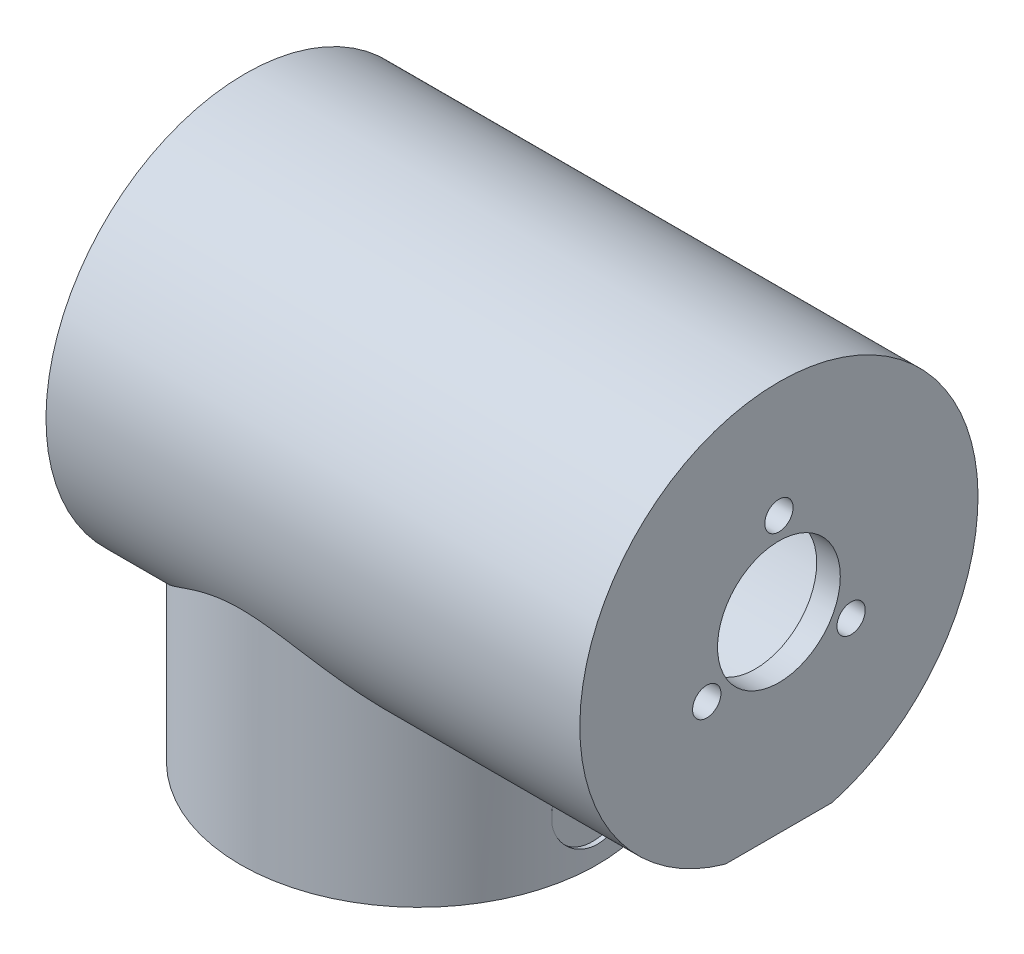
from build123d import *
from build123d.topology import SkipClean

# Parameters (mm, degrees)
SKETCH1_R             = 15.125
SKETCH1_R_2           = 10.125
BOSS_EXTRUDE1_DEPTH   = 10
SKETCH1_R_3           = 8.875
SKETCH1_R_4           = 4.875
BOSS_EXTRUDE1_2_DEPTH = 10
SKETCH28_W            = 1.8
SKETCH28_H            = 30.25
SKETCH30_R            = 3.5
CUT_EXTRUDE4_DEPTH    = 0.4
BOSS_EXTRUDE3_START   = -43.225
SKETCH3_R             = 11.25
BOSS_EXTRUDE3_DEPTH   = 43.225
BOSS_EXTRUDE2_REACH   = 48.827
SKETCH31_R            = 5.2
BOSS_EXTRUDE4_DEPTH   = 2
M2_CLEARANCE_HOLE1_D  = 2.4


with BuildPart() as part:
    # Sketch1 → Boss-Extrude1 (new body)
    with BuildSketch(Plane(origin=(0, 0, 0), x_dir=(1, 0, 0), z_dir=(0, 1, 0))):
        with Locations(Location((0, 0, 0), (0, 0, 270))):
            Circle(SKETCH1_R)
        with Locations(Location((0, 0, 0), (0, 0, 270))):
            Circle(SKETCH1_R_2, mode=Mode.SUBTRACT)
    extrude(amount=-BOSS_EXTRUDE1_DEPTH)


with BuildPart() as body_2:
    # Sketch1 → Boss-Extrude1 2 (new body)
    with BuildSketch(Plane(origin=(0, 0, 0), x_dir=(1, 0, 0), z_dir=(0, 1, 0))):
        with Locations(Location((0, 0, 0), (0, 0, 270))):
            Circle(SKETCH1_R_3)
        with Locations(Location((0, 0, 0), (0, 0, 270))):
            Circle(SKETCH1_R_4, mode=Mode.SUBTRACT)
    extrude(amount=-BOSS_EXTRUDE1_2_DEPTH)


with BuildPart() as m3_clearance_hole1_tool:
    # Sketch28 → M3 Clearance Hole1 (revolve)
    with BuildSketch(Plane(origin=(15.125, -5, 0), x_dir=(0, 0, -1), z_dir=(0, 1, 0))):
        with Locations((0.9, 15.125)):
            Rectangle(SKETCH28_W, SKETCH28_H)
    revolve(axis=Axis((21.475, -5, 0), (-1, 0, 0)))


with BuildPart() as part_1:
    add(part.part)

    # M3 Clearance Hole1: cut by m3_clearance_hole1_tool
    add(m3_clearance_hole1_tool.part, mode=Mode.SUBTRACT)

    # Sketch30 → Cut-Extrude4 (cut)
    with BuildSketch(Plane(origin=(15.125, 0, 0), x_dir=(0, 0, -1), z_dir=(1, 0, 0))):
        with Locations((0, -5)):
            Circle(SKETCH30_R)
    cut_extrude4 = extrude(amount=-CUT_EXTRUDE4_DEPTH, mode=Mode.SUBTRACT)

    # Mirror1: Cut-Extrude4 across plane
    add(cut_extrude4.mirror(Plane(origin=(0, 0, 0), x_dir=(0, 0, 1), z_dir=(1, 0, 0))), mode=Mode.SUBTRACT)



with BuildPart() as body_2_1:
    add(body_2.part)

    # M3 Clearance Hole1: cut by m3_clearance_hole1_tool
    add(m3_clearance_hole1_tool.part, mode=Mode.SUBTRACT)


with BuildPart() as part_2:
    add(part_1.part)

    add(body_2_1.part)  # Boss-Extrude3 merges body 2
    # Sketch3 → Boss-Extrude3 (add)
    with BuildSketch(Plane(origin=(28.5, 0, 0), x_dir=(0, 0, -1), z_dir=(1, 0, 0)).offset(BOSS_EXTRUDE3_START)):
        with BuildLine():
            Line((4.51796247, -0.01), (-4.51796247, -0.01))
            ThreePointArc((-4.51796247, -0.01), (0, 33.10637142), (4.51796247, -0.01))
        make_face()
        with Locations((0, 16.24)):
            Circle(SKETCH3_R, mode=Mode.SUBTRACT)
    extrude(amount=BOSS_EXTRUDE3_DEPTH)

    # Sketch2 → Boss-Extrude2 (add, up to next)
    with BuildSketch(Plane(origin=(0, 0, 0), x_dir=(1, 0, 0), z_dir=(0, 1, 0)), mode=Mode.PRIVATE) as boss_extrude2_sk1:
        with BuildLine():
            Line((14.423201452, -4.553776991), (-14.423201452, -4.553776991))
            ThreePointArc((-14.423201452, -4.553776991), (0, -15.125), (14.423201452, -4.553776991))
        make_face()
    boss_extrude2_tool1 = extrude(boss_extrude2_sk1.sketch, amount=BOSS_EXTRUDE2_REACH, mode=Mode.PRIVATE) - part_2.part
    # Sketch2 → Boss-Extrude2 (add, up to next)
    with BuildSketch(Plane(origin=(0, 0, 0), x_dir=(1, 0, 0), z_dir=(0, 1, 0)), mode=Mode.PRIVATE) as boss_extrude2_sk2:
        with BuildLine():
            Line((14.423201452, 4.553776991), (-14.423201452, 4.553776991))
            ThreePointArc((-14.423201452, 4.553776991), (0, 15.125), (14.423201452, 4.553776991))
        make_face()
    boss_extrude2_tool2 = extrude(boss_extrude2_sk2.sketch, amount=BOSS_EXTRUDE2_REACH, mode=Mode.PRIVATE) - part_2.part
    add(boss_extrude2_tool1.solids().sort_by_distance((0, 0, 8.941745))[0])
    add(boss_extrude2_tool2.solids().sort_by_distance((0, 0, -8.941745))[0])

    # Sketch31 → Boss-Extrude4 (add)
    with SkipClean():  # the faces are left unmerged after this step: merging them gives an invalid solid
        with BuildSketch(Plane(origin=(28.5, 0, 0), x_dir=(0, 0, -1), z_dir=(1, 0, 0))):
            with BuildLine():
                Line((-4.51796247, -0.01), (4.51796247, -0.01))
                ThreePointArc((4.51796247, -0.01), (0, 33.10637142), (-4.51796247, -0.01))
            make_face()
            with Locations((0, 16.24)):
                Circle(SKETCH31_R, mode=Mode.SUBTRACT)
        extrude(amount=BOSS_EXTRUDE4_DEPTH)

    # M2 Clearance Hole1 (through all)
    with Locations(Plane(origin=(30.5, 0, 0), x_dir=(0, 0, 1), z_dir=(1, 0, 0))):
        with Locations((0, -23.3), (6.114139351, -12.71), (-6.114139351, -12.71), (0, -16.24)):
            Hole(M2_CLEARANCE_HOLE1_D / 2)


solid = part_2.part
